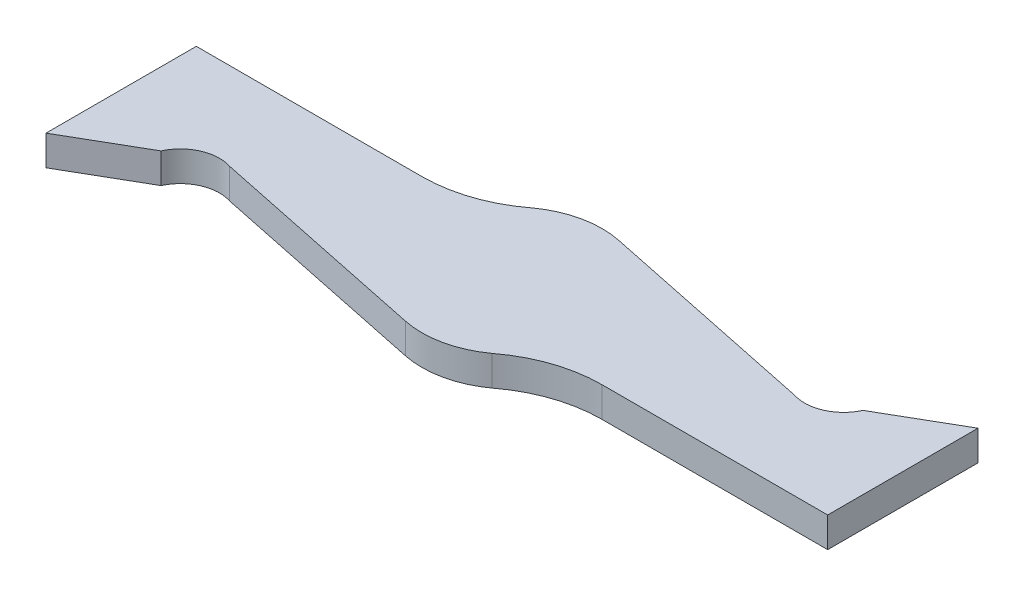
from build123d import *

# Parameters (mm, degrees)
SKETCH1_R           = 38.1
BOSS_EXTRUDE1_DEPTH = 12.7


with BuildPart() as part:
    # Sketch1 → Boss-Extrude1 (new body)
    with BuildSketch(Plane(origin=(0, 0, 0), x_dir=(1, 0, 0), z_dir=(0, 1, 0))):
        with BuildLine():
            Line((-57.15762, 19.05), (-152.4, 19.05))
            Line((-152.4, 19.05), (-152.4, -44.45))
            Line((-152.4, -44.45), (-121.604136641, -26.67))
            ThreePointArc((-121.604136641, -26.67), (-113.271041312, -18.424847404), (-101.565513762, -17.789517681))
            Line((-101.565513762, -17.789517681), (-7.767081629, -37.301484625))
            ThreePointArc((-7.767081629, -37.301484625), (-37.11967814, -8.620042959), (-23.413788565, 30.062622525))
            ThreePointArc((-23.413788565, 30.062622525), (-39.409915819, 21.872803477), (-57.15762, 19.05))
        make_face()
        with Locations((-0.00762, 0)):
            Circle(SKETCH1_R)
        with BuildLine():
            Line((152.4, -19.05), (152.4, 44.45))
            Line((152.4, 44.45), (121.604136641, 26.67))
            ThreePointArc((121.604136641, 26.67), (113.271041375, 18.424847303), (101.565513804, 17.789517483))
            Line((101.565513804, 17.789517483), (7.750633458, 37.301735929))
            ThreePointArc((7.750633458, 37.301735929), (29.549100528, 24.041844181), (38.09238, 0))
            ThreePointArc((38.09238, 0), (34.18553193, -16.805902567), (23.266219313, -30.165185291))
            ThreePointArc((23.266219313, -30.165185291), (39.319843399, -21.899781819), (57.15, -19.05))
            Line((57.15, -19.05), (152.4, -19.05))
        make_face()
    extrude(amount=BOSS_EXTRUDE1_DEPTH)


solid = part.part
